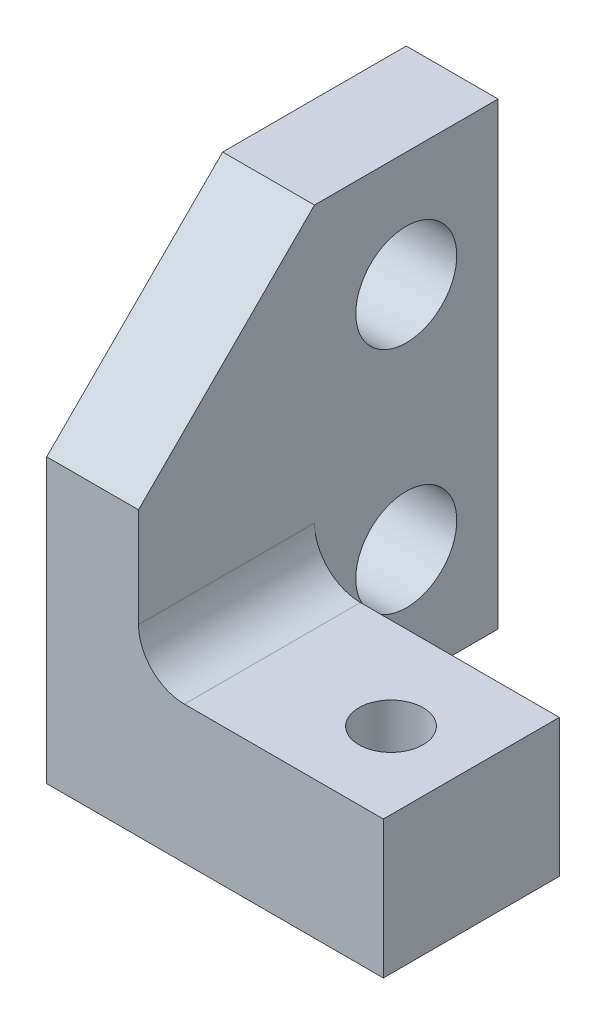
from build123d import *

# Parameters (mm, degrees)
SKETCH_1_W          = 22
SKETCH_1_H          = 30
EXTRUDE_1_DEPTH     = 23.5
SKETCH_2_W          = 16
SKETCH_2_H          = 12
CUT_EXTRUDE_1_DEPTH = 40.664215611
SKETCH_3_W          = 16
SKETCH_3_H          = 21
CUT_EXTRUDE_2_DEPTH = 30.970819141
HOLE_WIZARD_M6_1_D  = 6.6
HOLE_WIZARD_M5_1_D  = 4.2
CUT_EXTRUDE_3_DEPTH = 36.514081714
FILLET_1_R          = 3


with BuildPart() as part:
    # 草图1 → 凸台-拉伸1 (new body)
    with BuildSketch(Plane.XY):
        Rectangle(SKETCH_1_W, SKETCH_1_H)
    extrude(amount=EXTRUDE_1_DEPTH)

    # 草图2 → 切除-拉伸1 (cut, through all)
    with BuildSketch(Plane(origin=(0, 15, 0), x_dir=(1, 0, 0), z_dir=(0, 1, 0))):
        with Locations((3, -6)):
            Rectangle(SKETCH_2_W, SKETCH_2_H)
    extrude(amount=-CUT_EXTRUDE_1_DEPTH, mode=Mode.SUBTRACT)

    # 草图3 → 切除-拉伸2 (cut, through all)
    with BuildSketch(Plane.XY.offset(23.5)):
        with Locations((3, 4.5)):
            Rectangle(SKETCH_3_W, SKETCH_3_H)
    extrude(amount=-CUT_EXTRUDE_2_DEPTH, mode=Mode.SUBTRACT)

    # M6 间隙孔1 (through all)
    with Locations(Plane.ZY.offset(11)):
        with Locations((6, 7.5), (6, -7.5)):
            Hole(HOLE_WIZARD_M6_1_D / 2)

    # M5 螺纹孔1 (through all)
    with Locations(Plane(origin=(-30.5, -15, 32.5), x_dir=(-1, 0, 0), z_dir=(0, -1, 0))):
        with Locations((-36.5, 14.5)):
            Hole(HOLE_WIZARD_M5_1_D / 2)

    # 草图8 → 切除-拉伸3 (cut, through all)
    with BuildSketch(Plane.ZY.offset(11)):
        Polygon((12, 15), (23.5, 3.5), (23.5, 15), align=None)
    extrude(amount=-CUT_EXTRUDE_3_DEPTH, mode=Mode.SUBTRACT)

    # 圆角1
    fillet_1_edges = [part.edges().sort_by_distance(p)[0] for p in [
        (-5, -6, 17.75),
    ]]
    fillet(fillet_1_edges, radius=FILLET_1_R)


solid = part.part
